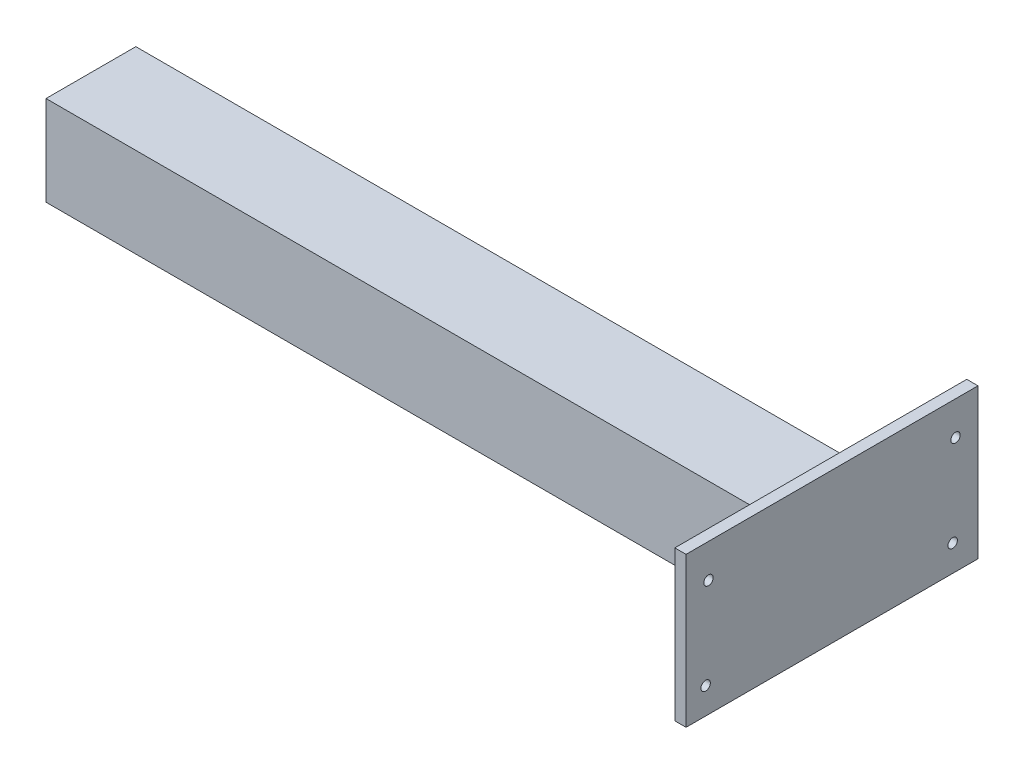
from build123d import *

# Parameters (mm, degrees)
SKETCH_1_W              = 400
SKETCH_1_H              = 40
EXTRUDE_1_DEPTH         = 40
SKETCH_2_W              = 11
SKETCH_2_H              = 10
EXTRUDE_2_DEPTH         = 400
EXTRUDE_4_DEPTH         = 5
HOLE_WIZARD_4_2_4_2_1_D = 4.2
SKETCH_17_W             = 50
SKETCH_17_H             = 40
CUT_EXTRUDE_5_DEPTH     = 50
SKETCH_22_W             = 130
SKETCH_22_H             = 27.153648059
CUT_EXTRUDE_11_DEPTH    = 10
HOLE_WIZARD_1_0_4_2_1_D = 4.2
SKETCH_30_W             = 50
SKETCH_30_H             = 1
CUT_EXTRUDE_13_DEPTH    = 10
SKETCH_31_W             = 8
SKETCH_31_H             = 10
EXTRUDE_6_DEPTH         = 350
CUT_EXTRUDE_16_DEPTH    = 8
CUT_EXTRUDE_17_DEPTH    = 5
SKETCH_34_W             = 345
SKETCH_34_H             = 8.718528554
CUT_EXTRUDE_18_DEPTH    = 10
SKETCH_36_W             = 8
SKETCH_36_H             = 1.281471446
CUT_EXTRUDE_19_DEPTH    = 345
SKETCH_47_W             = 11
SKETCH_47_H             = 10
CUT_EXTRUDE_25_DEPTH    = 345
SKETCH_48_W             = 14
SKETCH_48_H             = 10
EXTRUDE_16_DEPTH        = 345
SKETCH_50_W             = 8
SKETCH_50_H             = 10
EXTRUDE_17_DEPTH        = 345
CUT_EXTRUDE_26_DEPTH    = 8
CUT_EXTRUDE_28_DEPTH    = 5
CUT_EXTRUDE_29_DEPTH    = 5


with BuildPart() as part:
    # 草图1 → 凸台-拉伸1 (new body)
    with BuildSketch(Plane.XY):
        Rectangle(SKETCH_1_W, SKETCH_1_H)
    extrude(amount=-EXTRUDE_1_DEPTH)

    # 草图2 → 凸台-拉伸2 (add)
    with BuildSketch(Plane(origin=(200, 0, 0), x_dir=(0, 0, -1), z_dir=(1, 0, 0))):
        with Locations((45.5, -15)):
            Rectangle(SKETCH_2_W, SKETCH_2_H)
    extrude(amount=-EXTRUDE_2_DEPTH)

    # 草图10 → 凸台-拉伸4 (add)
    with BuildSketch(Plane(origin=(200, 0, 0), x_dir=(0, 0, -1), z_dir=(1, 0, 0))):
        Polygon((70, 0), (70, 46.719988926), (-60, 46.719988926), (-60, -47.280011074), (70, -47.280011074), align=None)
    extrude(amount=EXTRUDE_4_DEPTH)

    # Ø4.2 (4.2) 直径孔1 (through all)
    with Locations(Plane.ZY.offset(-200)):
        with Locations((-60, 31.719988926), (50, 31.719988926), (50, -28.280011074), (-60, -28.280011074)):
            Hole(HOLE_WIZARD_4_2_4_2_1_D / 2)

    # 草图17 → 切除-拉伸5 (cut)
    with BuildSketch(Plane.XY):
        with Locations((-175, 0)):
            Rectangle(SKETCH_17_W, SKETCH_17_H)
    extrude(amount=-CUT_EXTRUDE_5_DEPTH, mode=Mode.SUBTRACT)

    # 草图22 → 切除-拉伸11 (cut)
    with BuildSketch(Plane.ZY.offset(-200)):
        with Locations((-5, -33.703187044)):
            Rectangle(SKETCH_22_W, SKETCH_22_H)
    extrude(amount=-CUT_EXTRUDE_11_DEPTH, mode=Mode.SUBTRACT)

    # Ø1.0 (4.2) 直径孔1 (through all)
    with Locations(Plane.ZY.offset(-200)):
        with Locations((51.275492809, -8.280011074), (50, 31.719988926), (-60, 31.719988926), (-58.724507191, -8.280011074)):
            Hole(HOLE_WIZARD_1_0_4_2_1_D / 2)

    # 草图30 → 切除-拉伸13 (cut)
    with BuildSketch(Plane(origin=(0, -10, 0), x_dir=(1, 0, 0), z_dir=(0, 1, 0))):
        with Locations((-175, 50.5)):
            Rectangle(SKETCH_30_W, SKETCH_30_H)
    extrude(amount=-CUT_EXTRUDE_13_DEPTH, mode=Mode.SUBTRACT)

    # 草图31 → 凸台-拉伸6 (add)
    with BuildSketch(Plane.ZY.offset(-200)):
        with Locations((-47, -5)):
            Rectangle(SKETCH_31_W, SKETCH_31_H)
    extrude(amount=EXTRUDE_6_DEPTH)

    # 草图32 → 切除-拉伸16 (cut)
    with BuildSketch(Plane(origin=(0, 0, -51), x_dir=(-1, 0, 0), z_dir=(0, 0, -1))):
        Polygon((-65.344892399, -4.70562582), (-63.344892399, -4.70562582), (-61.933204653, 0), (-66.756580145, 0), align=None)
        Polygon((-198.588312254, -4.70562582), (-196.588312254, -4.70562582), (-195.176624508, 0), (-200, 0), align=None)
        Polygon((-191.534571541, -4.70562582), (-189.534571541, -4.70562582), (-188.122883795, 0), (-192.946259287, 0), align=None)
        Polygon((-184.5256427, -4.70562582), (-182.5256427, -4.70562582), (-181.113954954, 0), (-185.937330445, 0), align=None)
        Polygon((-177.471901986, -4.70562582), (-175.471901986, -4.70562582), (-174.06021424, 0), (-178.883589732, 0), align=None)
        Polygon((-156.490019181, -4.70562582), (-154.490019181, -4.70562582), (-153.078331435, 0), (-157.901706927, 0), align=None)
        Polygon((-163.498948022, -4.70562582), (-161.498948022, -4.70562582), (-160.087260277, 0), (-164.910635768, 0), align=None)
        Polygon((-170.552688736, -4.70562582), (-168.552688736, -4.70562582), (-167.14100099, 0), (-171.964376482, 0), align=None)
        Polygon((-149.436278468, -4.70562582), (-147.436278468, -4.70562582), (-146.024590722, 0), (-150.847966214, 0), align=None)
        Polygon((-121.42058865, -4.70562582), (-119.42058865, -4.70562582), (-118.008900904, 0), (-122.832276396, 0), align=None)
        Polygon((-128.474329364, -4.70562582), (-126.474329364, -4.70562582), (-125.062641618, 0), (-129.88601711, 0), align=None)
        Polygon((-135.483258205, -4.70562582), (-133.483258205, -4.70562582), (-132.071570459, 0), (-136.894945951, 0), align=None)
        Polygon((-142.536998918, -4.70562582), (-140.536998918, -4.70562582), (-139.125311172, 0), (-143.948686664, 0), align=None)
        Polygon((-93.398416826, -4.70562582), (-91.398416826, -4.70562582), (-89.98672908, 0), (-94.810104572, 0), align=None)
        Polygon((-100.452157539, -4.70562582), (-98.452157539, -4.70562582), (-97.040469793, 0), (-101.863845285, 0), align=None)
        Polygon((-107.461086381, -4.70562582), (-105.461086381, -4.70562582), (-104.049398635, 0), (-108.872774126, 0), align=None)
        Polygon((-114.514827094, -4.70562582), (-112.514827094, -4.70562582), (-111.103139348, 0), (-115.92651484, 0), align=None)
        Polygon((-72.398633112, -4.70562582), (-70.398633112, -4.70562582), (-68.986945366, 0), (-73.810320858, 0), align=None)
        Polygon((-79.407561953, -4.70562582), (-77.407561953, -4.70562582), (-75.995874207, 0), (-80.819249699, 0), align=None)
        Polygon((-86.461302667, -4.70562582), (-84.461302667, -4.70562582), (-83.049614921, 0), (-87.872990413, 0), align=None)
        Polygon((-37.046321813, -4.70562582), (-35.046321813, -4.70562582), (-33.634634067, 0), (-38.458009559, 0), align=None)
        Polygon((-44.100062526, -4.70562582), (-42.100062526, -4.70562582), (-40.688374781, 0), (-45.511750272, 0), align=None)
        Polygon((-51.108991368, -4.70562582), (-49.108991368, -4.70562582), (-47.697303622, 0), (-52.520679114, 0), align=None)
        Polygon((-58.162732081, -4.70562582), (-56.162732081, -4.70562582), (-54.751044335, 0), (-59.574419827, 0), align=None)
        Polygon((-30.143488196, -4.70562582), (-28.143488196, -4.70562582), (-26.73180045, 0), (-31.555175942, 0), align=None)
        Polygon((-23.089747483, -4.70562582), (-21.089747483, -4.70562582), (-19.678059737, 0), (-24.501435229, 0), align=None)
        Polygon((-16.080818642, -4.70562582), (-14.080818642, -4.70562582), (-12.669130896, 0), (-17.492506388, 0), align=None)
        Polygon((-9.027077928, -4.70562582), (-7.027077928, -4.70562582), (-5.615390183, 0), (-10.438765674, 0), align=None)
        Polygon((-2.157987317, -4.70562582), (-0.157987317, -4.70562582), (1.253700429, 0), (-3.569675063, 0), align=None)
        Polygon((4.895753396, -4.70562582), (6.895753396, -4.70562582), (8.307441142, 0), (3.48406565, 0), align=None)
        Polygon((11.904682238, -4.70562582), (13.904682238, -4.70562582), (15.316369984, 0), (10.492994492, 0), align=None)
        Polygon((18.958422951, -4.70562582), (20.958422951, -4.70562582), (22.370110697, 0), (17.546735205, 0), align=None)
        Polygon((46.979377546, -4.70562582), (48.979377546, -4.70562582), (50.391065292, 0), (45.5676898, 0), align=None)
        Polygon((39.925636833, -4.70562582), (41.925636833, -4.70562582), (43.337324579, 0), (38.513949087, 0), align=None)
        Polygon((32.916707991, -4.70562582), (34.916707991, -4.70562582), (36.328395737, 0), (31.505020245, 0), align=None)
        Polygon((25.862967278, -4.70562582), (27.862967278, -4.70562582), (29.274655024, 0), (24.451279532, 0), align=None)
        Polygon((74.984526322, -4.70562582), (76.984526322, -4.70562582), (78.396214068, 0), (73.572838576, 0), align=None)
        Polygon((67.930785609, -4.70562582), (69.930785609, -4.70562582), (71.342473355, 0), (66.519097863, 0), align=None)
        Polygon((60.921856768, -4.70562582), (62.921856768, -4.70562582), (64.333544513, 0), (59.510169022, 0), align=None)
        Polygon((53.868116054, -4.70562582), (55.868116054, -4.70562582), (57.2798038, 0), (52.456428308, 0), align=None)
        Polygon((103.003742011, -4.70562582), (105.003742011, -4.70562582), (106.415429757, 0), (101.592054265, 0), align=None)
        Polygon((95.950001298, -4.70562582), (97.950001298, -4.70562582), (99.361689044, 0), (94.538313552, 0), align=None)
        Polygon((88.941072456, -4.70562582), (90.941072456, -4.70562582), (92.352760202, 0), (87.52938471, 0), align=None)
        Polygon((81.887331743, -4.70562582), (83.887331743, -4.70562582), (85.299019489, 0), (80.475643997, 0), align=None)
        Polygon((131.075617593, -4.70562582), (133.075617593, -4.70562582), (134.487305338, 0), (129.663929847, 0), align=None)
        Polygon((124.021876879, -4.70562582), (126.021876879, -4.70562582), (127.433564625, 0), (122.610189133, 0), align=None)
        Polygon((117.012948038, -4.70562582), (119.012948038, -4.70562582), (120.424635784, 0), (115.601260292, 0), align=None)
        Polygon((109.959207325, -4.70562582), (111.959207325, -4.70562582), (113.370895071, 0), (108.547519579, 0), align=None)
        Polygon((138.075617593, -4.70562582), (140.075617593, -4.70562582), (141.487305338, 0), (136.663929847, 0), align=None)
        Polygon((145.075617593, -4.70562582), (147.075617593, -4.70562582), (148.487305338, 0), (143.663929847, 0), align=None)
    extrude(amount=-CUT_EXTRUDE_16_DEPTH, mode=Mode.SUBTRACT)

    # 草图33 → 切除-拉伸17 (cut)
    with BuildSketch(Plane.ZY.offset(150)):
        Polygon((-40, 20), (0, 20), (0, -20), (-51, -20), (-51, 0), (-43, 0), (-43, -10), (-40, -10), align=None)
    extrude(amount=-CUT_EXTRUDE_17_DEPTH, mode=Mode.SUBTRACT)

    # 草图34 → 切除-拉伸18 (cut)
    with BuildSketch(Plane(origin=(0, 0, -51), x_dir=(-1, 0, 0), z_dir=(0, 0, -1))):
        with Locations((-27.5, -4.359264277)):
            Rectangle(SKETCH_34_W, SKETCH_34_H)
    extrude(amount=-CUT_EXTRUDE_18_DEPTH, mode=Mode.SUBTRACT)

    # 草图36 → 切除-拉伸19 (cut)
    with BuildSketch(Plane.ZY.offset(145)):
        with Locations((-47, -9.359264277)):
            Rectangle(SKETCH_36_W, SKETCH_36_H)
    extrude(amount=-CUT_EXTRUDE_19_DEPTH, mode=Mode.SUBTRACT)

    # 草图47 → 切除-拉伸25 (cut)
    with BuildSketch(Plane(origin=(200, -20, -51), x_dir=(0, 0, -1), z_dir=(1, 0, 0))):
        with Locations((-5.5, 5)):
            Rectangle(SKETCH_47_W, SKETCH_47_H)
    extrude(amount=-CUT_EXTRUDE_25_DEPTH, mode=Mode.SUBTRACT)

    # 草图48 → 凸台-拉伸16 (add)
    with BuildSketch(Plane.ZY.offset(-200)):
        with Locations((-47, -15)):
            Rectangle(SKETCH_48_W, SKETCH_48_H)
    extrude(amount=EXTRUDE_16_DEPTH)

    # 草图50 → 凸台-拉伸17 (add)
    with BuildSketch(Plane.ZY.offset(-200)):
        with Locations((-50, -5)):
            Rectangle(SKETCH_50_W, SKETCH_50_H)
    extrude(amount=EXTRUDE_17_DEPTH)

    # 草图51 → 切除-拉伸26 (cut)
    with BuildSketch(Plane(origin=(0, 0, -54), x_dir=(-1, 0, 0), z_dir=(0, 0, -1))):
        Polygon((-200, 0), (-195, 0), (-196.5, -5), (-198.50906438, -5), align=None)
        Polygon((-192.972404015, 0), (-187.972404015, 0), (-189.472404015, -5), (-191.481468395, -5), align=None)
        Polygon((-178.955319384, 0), (-173.955319384, 0), (-175.455319384, -5), (-177.464383764, -5), align=None)
        Polygon((-185.982915368, 0), (-180.982915368, 0), (-182.482915368, -5), (-184.491979748, -5), align=None)
        Polygon((-150.912607805, 0), (-145.912607805, 0), (-147.412607805, -5), (-149.421672185, -5), align=None)
        Polygon((-157.94020379, 0), (-152.94020379, 0), (-154.44020379, -5), (-156.44926817, -5), align=None)
        Polygon((-164.929692436, 0), (-159.929692436, 0), (-161.429692436, -5), (-163.438756816, -5), align=None)
        Polygon((-171.957288421, 0), (-166.957288421, 0), (-168.457288421, -5), (-170.466352801, -5), align=None)
        Polygon((-122.912607805, 0), (-117.912607805, 0), (-119.412607805, -5), (-121.421672185, -5), align=None)
        Polygon((-129.94020379, 0), (-124.94020379, 0), (-126.44020379, -5), (-128.44926817, -5), align=None)
        Polygon((-136.929692436, 0), (-131.929692436, 0), (-133.429692436, -5), (-135.438756816, -5), align=None)
        Polygon((-143.957288421, 0), (-138.957288421, 0), (-140.457288421, -5), (-142.466352801, -5), align=None)
        Polygon((-94.912607805, 0), (-89.912607805, 0), (-91.412607805, -5), (-93.421672185, -5), align=None)
        Polygon((-101.94020379, 0), (-96.94020379, 0), (-98.44020379, -5), (-100.44926817, -5), align=None)
        Polygon((-108.929692436, 0), (-103.929692436, 0), (-105.429692436, -5), (-107.438756816, -5), align=None)
        Polygon((-115.957288421, 0), (-110.957288421, 0), (-112.457288421, -5), (-114.466352801, -5), align=None)
        Polygon((-66.912607805, 0), (-61.912607805, 0), (-63.412607805, -5), (-65.421672185, -5), align=None)
        Polygon((-73.94020379, 0), (-68.94020379, 0), (-70.44020379, -5), (-72.44926817, -5), align=None)
        Polygon((-80.929692436, 0), (-75.929692436, 0), (-77.429692436, -5), (-79.438756816, -5), align=None)
        Polygon((-87.957288421, 0), (-82.957288421, 0), (-84.457288421, -5), (-86.466352801, -5), align=None)
        Polygon((-38.912607805, 0), (-33.912607805, 0), (-35.412607805, -5), (-37.421672185, -5), align=None)
        Polygon((-45.94020379, 0), (-40.94020379, 0), (-42.44020379, -5), (-44.44926817, -5), align=None)
        Polygon((-52.929692436, 0), (-47.929692436, 0), (-49.429692436, -5), (-51.438756816, -5), align=None)
        Polygon((-59.957288421, 0), (-54.957288421, 0), (-56.457288421, -5), (-58.466352801, -5), align=None)
        Polygon((-10.912607805, 0), (-5.912607805, 0), (-7.412607805, -5), (-9.421672185, -5), align=None)
        Polygon((-17.94020379, 0), (-12.94020379, 0), (-14.44020379, -5), (-16.44926817, -5), align=None)
        Polygon((-24.929692436, 0), (-19.929692436, 0), (-21.429692436, -5), (-23.438756816, -5), align=None)
        Polygon((-31.957288421, 0), (-26.957288421, 0), (-28.457288421, -5), (-30.466352801, -5), align=None)
        Polygon((17.087392195, 0), (22.087392195, 0), (20.587392195, -5), (18.578327815, -5), align=None)
        Polygon((10.05979621, 0), (15.05979621, 0), (13.55979621, -5), (11.55073183, -5), align=None)
        Polygon((3.070307564, 0), (8.070307564, 0), (6.570307564, -5), (4.561243184, -5), align=None)
        Polygon((-3.957288421, 0), (1.042711579, 0), (-0.457288421, -5), (-2.466352801, -5), align=None)
        Polygon((45.087392195, 0), (50.087392195, 0), (48.587392195, -5), (46.578327815, -5), align=None)
        Polygon((38.05979621, 0), (43.05979621, 0), (41.55979621, -5), (39.55073183, -5), align=None)
        Polygon((31.070307564, 0), (36.070307564, 0), (34.570307564, -5), (32.561243184, -5), align=None)
        Polygon((24.042711579, 0), (29.042711579, 0), (27.542711579, -5), (25.533647199, -5), align=None)
        Polygon((73.087392195, 0), (78.087392195, 0), (76.587392195, -5), (74.578327815, -5), align=None)
        Polygon((66.05979621, 0), (71.05979621, 0), (69.55979621, -5), (67.55073183, -5), align=None)
        Polygon((59.070307564, 0), (64.070307564, 0), (62.570307564, -5), (60.561243184, -5), align=None)
        Polygon((52.042711579, 0), (57.042711579, 0), (55.542711579, -5), (53.533647199, -5), align=None)
        Polygon((101.087392195, 0), (106.087392195, 0), (104.587392195, -5), (102.578327815, -5), align=None)
        Polygon((94.05979621, 0), (99.05979621, 0), (97.55979621, -5), (95.55073183, -5), align=None)
        Polygon((87.070307564, 0), (92.070307564, 0), (90.570307564, -5), (88.561243184, -5), align=None)
        Polygon((80.042711579, 0), (85.042711579, 0), (83.542711579, -5), (81.533647199, -5), align=None)
        Polygon((129.087392195, 0), (134.087392195, 0), (132.587392195, -5), (130.578327815, -5), align=None)
        Polygon((122.05979621, 0), (127.05979621, 0), (125.55979621, -5), (123.55073183, -5), align=None)
        Polygon((115.070307564, 0), (120.070307564, 0), (118.570307564, -5), (116.561243184, -5), align=None)
        Polygon((108.042711579, 0), (113.042711579, 0), (111.542711579, -5), (109.533647199, -5), align=None)
        Polygon((143.087392195, 0), (148.087392195, 0), (146.587392195, -5), (144.578327815, -5), align=None)
        Polygon((136.05979621, 0), (141.05979621, 0), (139.55979621, -5), (137.55073183, -5), align=None)
    extrude(amount=-CUT_EXTRUDE_26_DEPTH, mode=Mode.SUBTRACT)

    # 草图52 → 切除-拉伸28 (cut)
    with BuildSketch(Plane.ZY.offset(145)):
        Polygon((-54, 0), (-46, 0), (-46, -10), (-40, -10), (-40, 20), (0, 20), (0, -20), (-54, -20), align=None)
    extrude(amount=-CUT_EXTRUDE_28_DEPTH, mode=Mode.SUBTRACT)

    # 草图54 → 切除-拉伸29 (cut)
    with BuildSketch(Plane.ZY.offset(-200)):
        Polygon((-70, -20.126363015), (60, -20.126363015), (60, -20), (-54, -20), (-70, -20), align=None)
    extrude(amount=-CUT_EXTRUDE_29_DEPTH, mode=Mode.SUBTRACT)


solid = part.part
